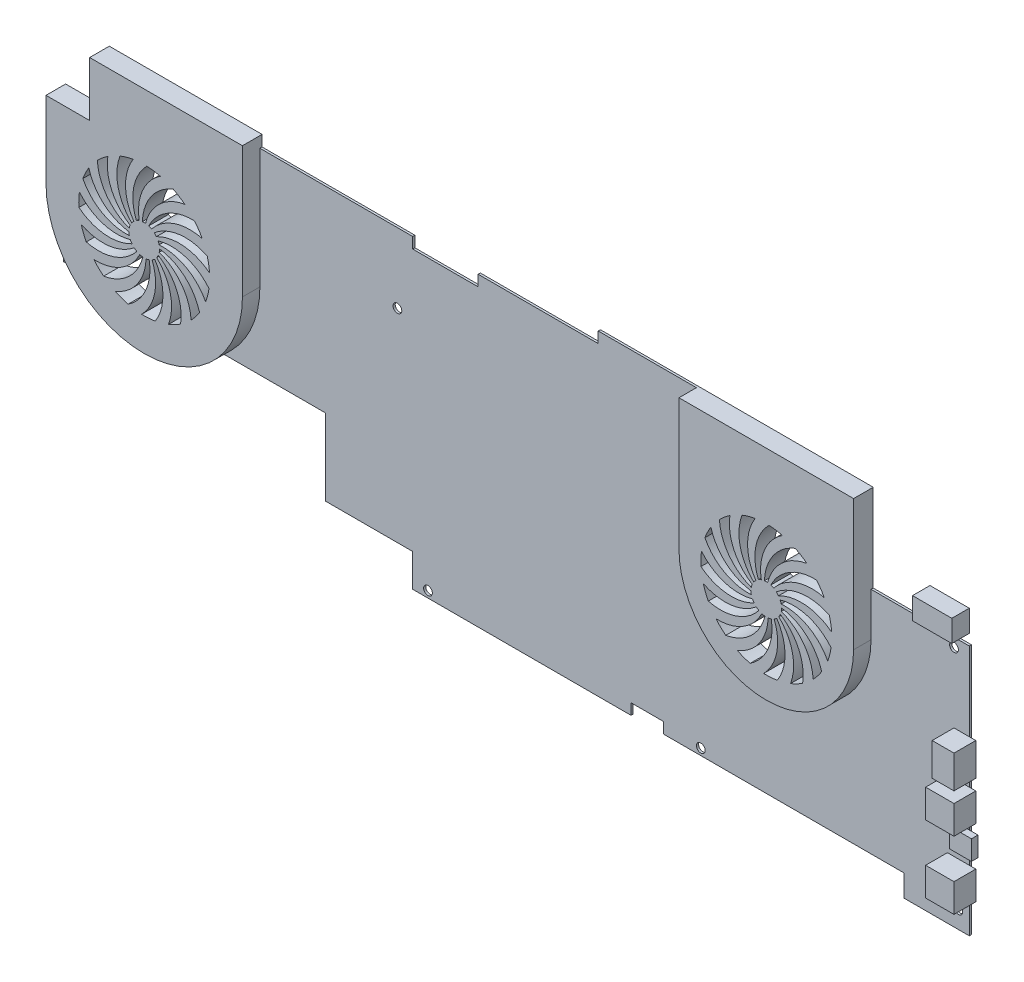
from build123d import *

# Parameters (mm, degrees)
EXTRUDE_2_DEPTH     = 1
SKETCH_4_R          = 2
CUT_EXTRUDE_1_DEPTH = 323.375557386
SKETCH_6_W          = 10
SKETCH_6_H          = 15
SKETCH_6_W_2        = 13
SKETCH_6_H_2        = 13
EXTRUDE_3_DEPTH     = 10
SKETCH_8_W          = 18
SKETCH_8_H          = 10
EXTRUDE_4_DEPTH     = 8
SKETCH_9_W          = 10
SKETCH_9_H          = 9
EXTRUDE_5_DEPTH     = 3
EXTRUDE_6_DEPTH     = 8
CUT_EXTRUDE_8_DEPTH = 327.162536169


with BuildPart() as part:
    # 草圖2 → 填料-伸長2 (new body)
    with BuildSketch(Plane.XY):
        Polygon((0, 0), (40, 0), (40, -15), (140, -15), (140, -10), (155, -10), (155, -15), (265, -15), (265, -25), (295, -25), (295, 90), (250, 90), (250, 130), (125, 130), (125, 125), (70, 125), (70, 120), (40, 120), (40, 125), (-30, 125), (-30, 130), (-100, 130), (-100, 105), (-120, 105), (-120, 35), (0, 35), align=None)
    extrude(amount=EXTRUDE_2_DEPTH)

    # 草圖4 → 除料-伸長1 (cut, through all)
    with BuildSketch(Plane.XY.offset(1)):
        with Locations((47, -12)):
            Circle(SKETCH_4_R)
        with Locations((172, -12)):
            Circle(SKETCH_4_R)
        with Locations((290, -17)):
            Circle(SKETCH_4_R)
        with Locations((288, 86)):
            Circle(SKETCH_4_R)
        with Locations((33, 93)):
            Circle(SKETCH_4_R)
    extrude(amount=-CUT_EXTRUDE_1_DEPTH, mode=Mode.SUBTRACT)

    # 草圖6 → 填料-伸長3 (add)
    with BuildSketch(Plane.XY.offset(1)):
        with Locations((293, 46.5)):
            Rectangle(SKETCH_6_W, SKETCH_6_H)
        with Locations((291.5, -3.5)):
            Rectangle(SKETCH_6_W_2, SKETCH_6_H_2)
        with Locations((291.5, 27.5)):
            Rectangle(SKETCH_6_W_2, SKETCH_6_H_2)
    extrude(amount=EXTRUDE_3_DEPTH)

    # 草圖9 → 填料-伸長5 (add)
    with BuildSketch(Plane.XY.offset(1)):
        with Locations((294, 12.5)):
            Rectangle(SKETCH_9_W, SKETCH_9_H)
    extrude(amount=EXTRUDE_5_DEPTH)

    # 草圖10 → 填料-伸長6 (add)
    with BuildSketch(Plane.XY.offset(1)):
        with BuildLine():
            Line((250, 130), (250, 70))
            ThreePointArc((250, 70), (210, 30), (170, 70))
            Line((170, 70), (170, 130))
            Line((170, 130), (250, 130))
        make_face()
        with BuildLine():
            Line((-30, 130), (-30, 70))
            ThreePointArc((-30, 70), (-75, 25), (-120, 70))
            Line((-120, 70), (-120, 105))
            Line((-120, 105), (-100, 105))
            Line((-100, 105), (-100, 130))
            Line((-100, 130), (-30, 130))
        make_face()
    extrude(amount=EXTRUDE_6_DEPTH)

    # 草圖11 → 除料-伸長8 (cut, through all)
    with BuildSketch(Plane.XY.offset(9)):
        with BuildLine():
            ThreePointArc((-93.583431313, 46.448862434), (-82.119240586, 52.051818924), (-75.609629136, 63.026596791))
            ThreePointArc((-75.609629136, 63.026596791), (-76.335208645, 63.12852142), (-77.046159329, 63.305731407))
            ThreePointArc((-77.046159329, 63.305731407), (-85.695304772, 53.92420309), (-98.073895584, 50.827223921))
            ThreePointArc((-98.073895584, 50.827223921), (-95.943393549, 48.520375547), (-93.583431313, 46.448862434))
        make_face()
        with BuildLine():
            ThreePointArc((-82.397698629, 40.926402785), (-74.203566979, 50.707864688), (-72.720585316, 63.381520666))
            ThreePointArc((-72.720585316, 63.381520666), (-73.424891662, 63.179513674), (-74.146455225, 63.052233358))
            ThreePointArc((-74.146455225, 63.052233358), (-78.232031423, 50.963856395), (-88.28078192, 43.09979867))
            ThreePointArc((-88.28078192, 43.09979867), (-85.3961917, 41.858941062), (-82.397698629, 40.926402785))
        make_face()
        with BuildLine():
            ThreePointArc((-69.932836646, 40.43103222), (-66.425603877, 52.699695911), (-70.225673003, 64.880839744))
            ThreePointArc((-70.225673003, 64.880839744), (-70.78692522, 64.409829976), (-71.394336767, 64.00006728))
            ThreePointArc((-71.394336767, 64.00006728), (-70.209910479, 51.295031868), (-76.19130041, 40.02366261))
            ThreePointArc((-76.19130041, 40.02366261), (-73.05139386, 40.063351321), (-69.932836646, 40.43103222))
        make_face()
        with BuildLine():
            ThreePointArc((-58.344133241, 45.04840481), (-60.13023176, 57.682906879), (-68.556285201, 67.265308137))
            ThreePointArc((-68.556285201, 67.265308137), (-68.877437682, 66.60673746), (-69.265670238, 65.985344077))
            ThreePointArc((-69.265670238, 65.985344077), (-63.016039529, 54.860466259), (-63.895832236, 42.130707611))
            ThreePointArc((-63.895832236, 42.130707611), (-61.043527723, 43.444080103), (-58.344133241, 45.04840481))
        make_face()
        with BuildLine():
            ThreePointArc((-68.001074227, 70.122629597), (-68.000268562, 70.061317151), (-68, 70))
            ThreePointArc((-68, 70), (-68.032204435, 69.329310079), (-68.12852142, 68.664791355))
            ThreePointArc((-68.12852142, 68.664791355), (-57.894304216, 61.043663573), (-53.520375547, 49.056606451))
            ThreePointArc((-53.520375547, 49.056606451), (-51.448862434, 51.416568687), (-49.635380513, 53.980134886))
            ThreePointArc((-49.635380513, 53.980134886), (-56.40597766, 64.795855146), (-68.001074227, 70.122629597))
        make_face()
        with BuildLine():
            ThreePointArc((-68.656041102, 72.958747286), (-68.381520666, 72.279414684), (-68.179513674, 71.575108338))
            ThreePointArc((-68.179513674, 71.575108338), (-55.730299104, 68.775492821), (-46.858941062, 59.6038083))
            ThreePointArc((-46.858941062, 59.6038083), (-45.926402785, 62.602301371), (-45.312400924, 65.681845177))
            ThreePointArc((-45.312400924, 65.681845177), (-55.896798944, 72.808647335), (-68.656041102, 72.958747286))
        make_face()
        with BuildLine():
            ThreePointArc((-46.122676918, 78.130203665), (-58.690737237, 80.335798885), (-70.407936104, 75.283270689))
            ThreePointArc((-70.407936104, 75.283270689), (-69.880839744, 74.774326997), (-69.409829976, 74.21307478))
            ThreePointArc((-69.409829976, 74.21307478), (-56.898200337, 76.719050484), (-45.063351321, 71.94860614))
            ThreePointArc((-45.063351321, 71.94860614), (-45.43103222, 75.067163354), (-46.122676918, 78.130203665))
        make_face()
        with BuildLine():
            ThreePointArc((-51.926104416, 89.172776079), (-64.304695228, 86.07579691), (-72.953840671, 76.694268593))
            ThreePointArc((-72.953840671, 76.694268593), (-72.265308137, 76.443714799), (-71.60673746, 76.122562318))
            ThreePointArc((-71.60673746, 76.122562318), (-61.196067181, 83.500823278), (-48.444080103, 83.956472277))
            ThreePointArc((-48.444080103, 83.956472277), (-50.04840481, 86.655866759), (-51.926104416, 89.172776079))
        make_face()
        with BuildLine():
            ThreePointArc((-61.71921808, 96.90020133), (-71.767968577, 89.036143605), (-75.853544775, 76.947766642))
            ThreePointArc((-75.853544775, 76.947766642), (-75.122629597, 76.998925773), (-74.390370864, 76.973403209))
            ThreePointArc((-74.390370864, 76.973403209), (-67.880759414, 87.948181076), (-56.416568687, 93.551137566))
            ThreePointArc((-56.416568687, 93.551137566), (-58.980134886, 95.364619487), (-61.71921808, 96.90020133))
        make_face()
        with BuildLine():
            ThreePointArc((-73.80869959, 99.97633739), (-79.790089521, 88.704968132), (-78.605663233, 75.99993272))
            ThreePointArc((-78.605663233, 75.99993272), (-77.958747286, 76.343958898), (-77.279414684, 76.618479334))
            ThreePointArc((-77.279414684, 76.618479334), (-75.796433021, 89.292135312), (-67.602301371, 99.073597215))
            ThreePointArc((-67.602301371, 99.073597215), (-70.681845177, 99.687599076), (-73.80869959, 99.97633739))
        make_face()
        with BuildLine():
            ThreePointArc((-86.104167764, 97.869292389), (-86.983960471, 85.139533741), (-80.734329762, 74.014655923))
            ThreePointArc((-80.734329762, 74.014655923), (-80.283270689, 74.592063896), (-79.774326997, 75.119160256))
            ThreePointArc((-79.774326997, 75.119160256), (-83.574396123, 87.300304089), (-80.067163354, 99.56896778))
            ThreePointArc((-80.067163354, 99.56896778), (-83.130203665, 98.877323082), (-86.104167764, 97.869292389))
        make_face()
        with BuildLine():
            ThreePointArc((-96.479624453, 90.943393549), (-92.105695784, 78.956336427), (-81.87147858, 71.335208645))
            ThreePointArc((-81.87147858, 71.335208645), (-81.694268593, 72.046159329), (-81.443714799, 72.734691863))
            ThreePointArc((-81.443714799, 72.734691863), (-89.86976824, 82.317093121), (-91.655866759, 94.95159519))
            ThreePointArc((-91.655866759, 94.95159519), (-94.172776079, 93.073895584), (-96.479624453, 90.943393549))
        make_face()
        with BuildLine():
            ThreePointArc((-103.141058938, 80.3961917), (-94.269700896, 71.224507179), (-81.820486326, 68.424891662))
            ThreePointArc((-81.820486326, 68.424891662), (-81.947766642, 69.146455225), (-81.998925773, 69.877370403))
            ThreePointArc((-81.998925773, 69.877370403), (-93.59402234, 75.204144854), (-100.364619487, 86.019865114))
            ThreePointArc((-100.364619487, 86.019865114), (-101.90020133, 83.28078192), (-103.141058938, 80.3961917))
        make_face()
        with BuildLine():
            ThreePointArc((-104.936648679, 68.05139386), (-93.101799663, 63.280949516), (-80.590170024, 65.78692522))
            ThreePointArc((-80.590170024, 65.78692522), (-80.99993272, 66.394336767), (-81.343958898, 67.041252714))
            ThreePointArc((-81.343958898, 67.041252714), (-94.103201056, 67.191352665), (-104.687599076, 74.318154823))
            ThreePointArc((-104.687599076, 74.318154823), (-104.97633739, 71.19130041), (-104.936648679, 68.05139386))
        make_face()
        with BuildLine():
            ThreePointArc((-101.555919897, 56.043527723), (-88.803932819, 56.499176722), (-78.39326254, 63.877437682))
            ThreePointArc((-78.39326254, 63.877437682), (-79.014655923, 64.265670238), (-79.592063896, 64.716729311))
            ThreePointArc((-79.592063896, 64.716729311), (-91.309262763, 59.664201115), (-103.877323082, 61.869796335))
            ThreePointArc((-103.877323082, 61.869796335), (-102.869292389, 58.895832236), (-101.555919897, 56.043527723))
        make_face()
        with BuildLine():
            ThreePointArc((202.602301371, 40.926402785), (210.796433021, 50.707864688), (212.279414684, 63.381520666))
            ThreePointArc((212.279414684, 63.381520666), (211.575108338, 63.179513674), (210.853544775, 63.052233358))
            ThreePointArc((210.853544775, 63.052233358), (206.767968577, 50.963856395), (196.71921808, 43.09979867))
            ThreePointArc((196.71921808, 43.09979867), (199.6038083, 41.858941062), (202.602301371, 40.926402785))
        make_face()
        with BuildLine():
            ThreePointArc((215.067163354, 40.43103222), (218.574396123, 52.699695911), (214.774326997, 64.880839744))
            ThreePointArc((214.774326997, 64.880839744), (214.21307478, 64.409829976), (213.605663233, 64.00006728))
            ThreePointArc((213.605663233, 64.00006728), (214.790089521, 51.295031868), (208.80869959, 40.02366261))
            ThreePointArc((208.80869959, 40.02366261), (211.94860614, 40.063351321), (215.067163354, 40.43103222))
        make_face()
        with BuildLine():
            ThreePointArc((226.655866759, 45.04840481), (224.86976824, 57.682906879), (216.443714799, 67.265308137))
            ThreePointArc((216.443714799, 67.265308137), (216.122562318, 66.60673746), (215.734329762, 65.985344077))
            ThreePointArc((215.734329762, 65.985344077), (221.983960471, 54.860466259), (221.104167764, 42.130707611))
            ThreePointArc((221.104167764, 42.130707611), (223.956472277, 43.444080103), (226.655866759, 45.04840481))
        make_face()
        with BuildLine():
            ThreePointArc((216.998925773, 70.122629597), (216.999731438, 70.061317151), (217, 70))
            ThreePointArc((217, 70), (216.967795565, 69.329310079), (216.87147858, 68.664791355))
            ThreePointArc((216.87147858, 68.664791355), (227.105695784, 61.043663573), (231.479624453, 49.056606451))
            ThreePointArc((231.479624453, 49.056606451), (233.551137566, 51.416568687), (235.364619487, 53.980134886))
            ThreePointArc((235.364619487, 53.980134886), (228.59402234, 64.795855146), (216.998925773, 70.122629597))
        make_face()
        with BuildLine():
            ThreePointArc((216.343958898, 72.958747286), (216.618479334, 72.279414684), (216.820486326, 71.575108338))
            ThreePointArc((216.820486326, 71.575108338), (229.269700896, 68.775492821), (238.141058938, 59.6038083))
            ThreePointArc((238.141058938, 59.6038083), (239.073597215, 62.602301371), (239.687599076, 65.681845177))
            ThreePointArc((239.687599076, 65.681845177), (229.103201056, 72.808647335), (216.343958898, 72.958747286))
        make_face()
        with BuildLine():
            ThreePointArc((238.877323082, 78.130203665), (226.309262763, 80.335798885), (214.592063896, 75.283270689))
            ThreePointArc((214.592063896, 75.283270689), (215.119160256, 74.774326997), (215.590170024, 74.21307478))
            ThreePointArc((215.590170024, 74.21307478), (228.101799663, 76.719050484), (239.936648679, 71.94860614))
            ThreePointArc((239.936648679, 71.94860614), (239.56896778, 75.067163354), (238.877323082, 78.130203665))
        make_face()
        with BuildLine():
            ThreePointArc((233.073895584, 89.172776079), (220.695304773, 86.07579691), (212.046159329, 76.694268593))
            ThreePointArc((212.046159329, 76.694268593), (212.734691863, 76.443714799), (213.39326254, 76.122562318))
            ThreePointArc((213.39326254, 76.122562318), (223.803932819, 83.500823278), (236.555919897, 83.956472277))
            ThreePointArc((236.555919897, 83.956472277), (234.95159519, 86.655866759), (233.073895584, 89.172776079))
        make_face()
        with BuildLine():
            ThreePointArc((223.28078192, 96.90020133), (213.232031423, 89.036143605), (209.146455225, 76.947766642))
            ThreePointArc((209.146455225, 76.947766642), (209.877370403, 76.998925773), (210.609629136, 76.973403209))
            ThreePointArc((210.609629136, 76.973403209), (217.119240586, 87.948181076), (228.583431313, 93.551137566))
            ThreePointArc((228.583431313, 93.551137566), (226.019865114, 95.364619487), (223.28078192, 96.90020133))
        make_face()
        with BuildLine():
            ThreePointArc((211.19130041, 99.97633739), (205.209910479, 88.704968132), (206.394336767, 75.99993272))
            ThreePointArc((206.394336767, 75.99993272), (207.041252714, 76.343958898), (207.720585316, 76.618479334))
            ThreePointArc((207.720585316, 76.618479334), (209.203566979, 89.292135312), (217.397698629, 99.073597215))
            ThreePointArc((217.397698629, 99.073597215), (214.318154823, 99.687599076), (211.19130041, 99.97633739))
        make_face()
        with BuildLine():
            ThreePointArc((198.895832236, 97.869292389), (198.016039529, 85.139533741), (204.265670238, 74.014655923))
            ThreePointArc((204.265670238, 74.014655923), (204.716729311, 74.592063896), (205.225673003, 75.119160256))
            ThreePointArc((205.225673003, 75.119160256), (201.425603877, 87.300304089), (204.932836646, 99.56896778))
            ThreePointArc((204.932836646, 99.56896778), (201.869796335, 98.877323082), (198.895832236, 97.869292389))
        make_face()
        with BuildLine():
            ThreePointArc((188.520375547, 90.943393549), (192.894304216, 78.956336427), (203.12852142, 71.335208645))
            ThreePointArc((203.12852142, 71.335208645), (203.305731407, 72.046159329), (203.556285201, 72.734691863))
            ThreePointArc((203.556285201, 72.734691863), (195.13023176, 82.317093121), (193.344133241, 94.95159519))
            ThreePointArc((193.344133241, 94.95159519), (190.827223921, 93.073895584), (188.520375547, 90.943393549))
        make_face()
        with BuildLine():
            ThreePointArc((181.858941062, 80.3961917), (190.730299104, 71.224507179), (203.179513674, 68.424891662))
            ThreePointArc((203.179513674, 68.424891662), (203.052233358, 69.146455225), (203.001074227, 69.877370403))
            ThreePointArc((203.001074227, 69.877370403), (191.40597766, 75.204144854), (184.635380513, 86.019865114))
            ThreePointArc((184.635380513, 86.019865114), (183.09979867, 83.28078192), (181.858941062, 80.3961917))
        make_face()
        with BuildLine():
            ThreePointArc((180.063351321, 68.05139386), (191.898200337, 63.280949516), (204.409829976, 65.78692522))
            ThreePointArc((204.409829976, 65.78692522), (204.00006728, 66.394336767), (203.656041102, 67.041252714))
            ThreePointArc((203.656041102, 67.041252714), (190.896798944, 67.191352665), (180.312400924, 74.318154823))
            ThreePointArc((180.312400924, 74.318154823), (180.02366261, 71.19130041), (180.063351321, 68.05139386))
        make_face()
        with BuildLine():
            ThreePointArc((183.444080103, 56.043527723), (196.196067181, 56.499176722), (206.60673746, 63.877437682))
            ThreePointArc((206.60673746, 63.877437682), (205.985344077, 64.265670238), (205.407936104, 64.716729311))
            ThreePointArc((205.407936104, 64.716729311), (193.690737237, 59.664201115), (181.122676918, 61.869796335))
            ThreePointArc((181.122676918, 61.869796335), (182.130707611, 58.895832236), (183.444080103, 56.043527723))
        make_face()
        with BuildLine():
            ThreePointArc((191.416568687, 46.448862434), (202.880759414, 52.051818924), (209.390370864, 63.026596791))
            ThreePointArc((209.390370864, 63.026596791), (208.664791355, 63.12852142), (207.953840671, 63.305731407))
            ThreePointArc((207.953840671, 63.305731407), (199.304695228, 53.92420309), (186.926104416, 50.827223921))
            ThreePointArc((186.926104416, 50.827223921), (189.056606451, 48.520375547), (191.416568687, 46.448862434))
        make_face()
    extrude(amount=-CUT_EXTRUDE_8_DEPTH, mode=Mode.SUBTRACT)


with BuildPart() as body_2:
    # 草圖8 → 填料-伸長4 (new body)
    with BuildSketch(Plane.XY.offset(1)):
        with Locations((286, 100)):
            Rectangle(SKETCH_8_W, SKETCH_8_H)
    extrude(amount=EXTRUDE_4_DEPTH)


solid = Compound([part.part, body_2.part])
